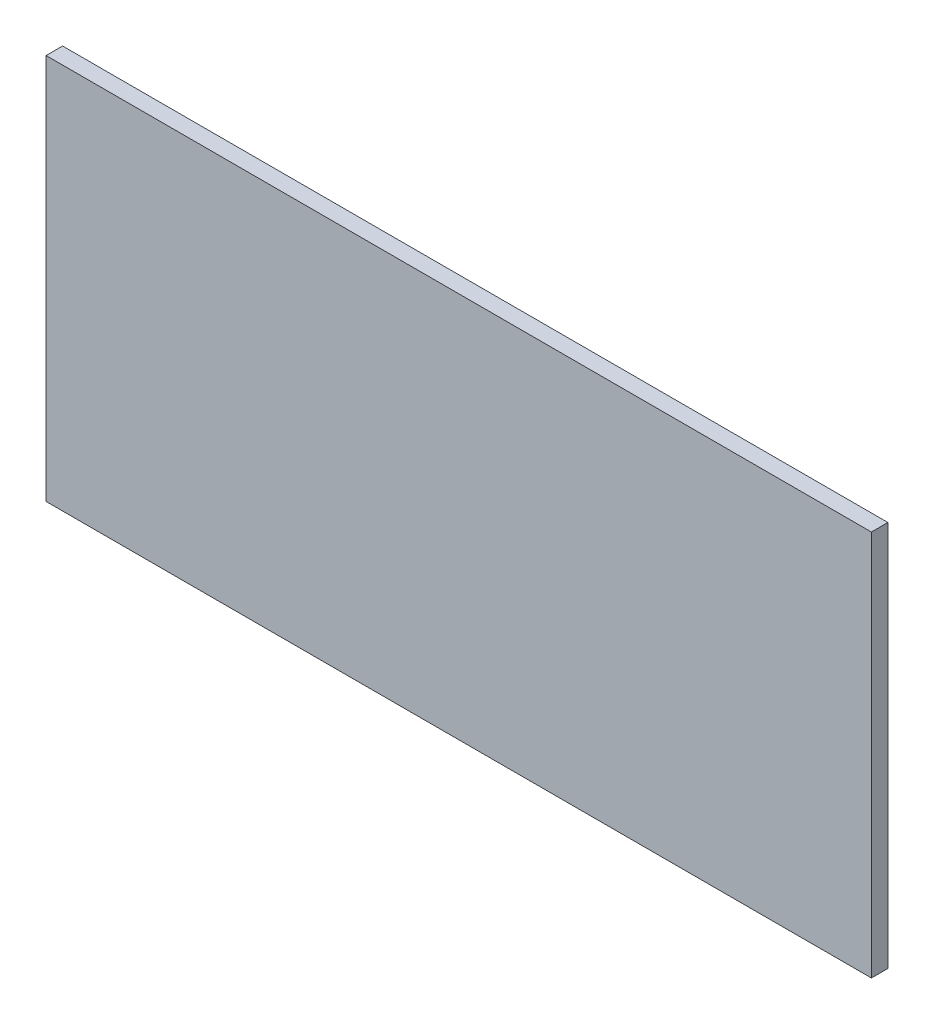
from build123d import *

# Parameters (mm, degrees)
SKETCH_1_W      = 50
SKETCH_1_H      = 23.4
EXTRUDE_1_DEPTH = 1


with BuildPart() as part:
    # 草图1 → 凸台-拉伸1 (new body)
    with BuildSketch(Plane.XY):
        with Locations((-25, 0)):
            Rectangle(SKETCH_1_W, SKETCH_1_H)
    extrude(amount=EXTRUDE_1_DEPTH)


solid = part.part
